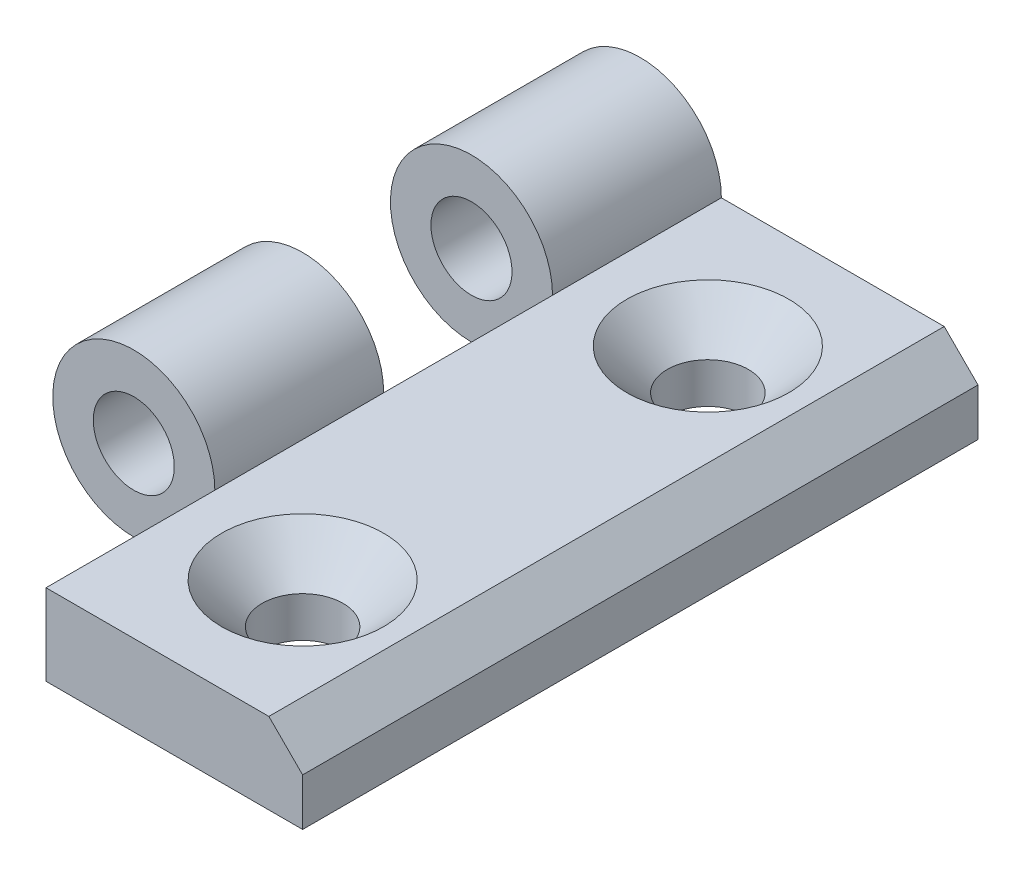
from build123d import *

# Parameters (mm, degrees)
SKETCH_1_R                = 6
EXTRUDE_1_DEPTH           = 50
SKETCH_2_W                = 25
SKETCH_2_H                = 6
EXTRUDE_2_DEPTH           = 50
SKETCH_5_R                = 3
CUT_EXTRUDE_1_DEPTH       = 50
HOLE_WIZARD_1_D           = 6
HOLE_WIZARD_1_CSINK_D     = 12
HOLE_WIZARD_1_CSINK_ANGLE = 90
CUT_EXTRUDE_2_DEPTH       = 12.5
PATTERN_LINEAR_2_COUNT    = 2
PATTERN_LINEAR_2_PITCH    = 25
CHAMFER_1_SIZE            = 2.5


with BuildPart() as part:
    # 草图1 → 凸台-拉伸1 (new body)
    with BuildSketch(Plane.XY):
        with Locations((-36.999696345, 47.332553752)):
            Circle(SKETCH_1_R)
    extrude(amount=EXTRUDE_1_DEPTH)

    # 草图2 → 凸台-拉伸2 (add)
    with BuildSketch(Plane.XY.offset(50)):
        with Locations((-24.499696345, 44.332553752)):
            Rectangle(SKETCH_2_W, SKETCH_2_H)
    extrude(amount=-EXTRUDE_2_DEPTH)

    # 草图5 → 切除-拉伸1 (cut)
    with BuildSketch(Plane.XY.offset(50)):
        with Locations((-36.999696345, 47.332553752)):
            Circle(SKETCH_5_R)
    extrude(amount=-CUT_EXTRUDE_1_DEPTH, mode=Mode.SUBTRACT)

    # 打孔尺寸(%根据)内六角花形半沉头螺钉的类型1 (through all)
    with Locations(Plane(origin=(0, 47.332553752, 0), x_dir=(1, 0, 0), z_dir=(0, 1, 0))):
        with Locations((-21.999696345, -40), (-21.999696345, -10)):
            CounterSinkHole(HOLE_WIZARD_1_D / 2, HOLE_WIZARD_1_CSINK_D / 2, counter_sink_angle=HOLE_WIZARD_1_CSINK_ANGLE)

    # 草图9 → 切除-拉伸2 (cut)
    with BuildSketch(Plane.XY.offset(50)):
        Polygon((-30.999696345, 47.332553752), (-30.999696345, 35.818106439), (-46.000108994, 35.818106439), (-46.000108994, 53.909109131), (-30.999696345, 53.909109131), align=None)
    cut_extrude_2 = extrude(amount=-CUT_EXTRUDE_2_DEPTH, mode=Mode.SUBTRACT)

    # 阵列(线性)2: 切除-拉伸2 ×2
    with Locations(*[(0, 0, -i * PATTERN_LINEAR_2_PITCH) for i in range(1, PATTERN_LINEAR_2_COUNT)]):
        add(cut_extrude_2, mode=Mode.SUBTRACT)

    # 倒角1
    chamfer_1_edges = [part.edges().sort_by_distance(p)[0] for p in [
        (-11.999696345, 47.332553752, 25),
    ]]
    chamfer(chamfer_1_edges, length=CHAMFER_1_SIZE)


solid = part.part
